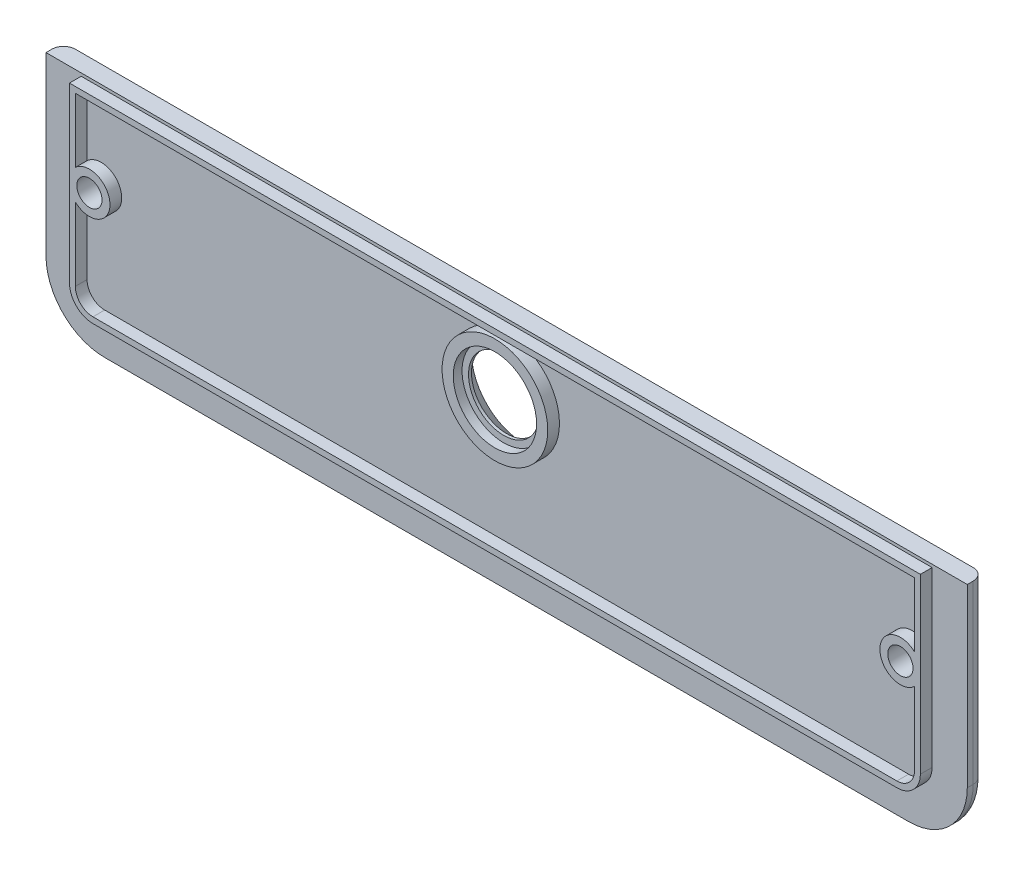
from build123d import *

# Parameters (mm, degrees)
BOSS_BASE_DEPTH    = 3
SKETCH3_R          = 2.15
BOSS_FIT_DEPTH     = 2
CUT_SCREWS_START   = -2
SKETCH4_R          = 2.15
CUT_SCREWS_DEPTH   = 2
FILLET1_R          = 2
CUT_VORON_DEPTH    = 0.6
SKETCH8_R          = 9
BOSS_BEARING_DEPTH = 2
SKETCH12_R         = 7.1
CUT_BEARING1_DEPTH = 1.5
SKETCH11_R         = 6
CUT_BEARING2_DEPTH = 157.057681644
CHAMFER2_SIZE      = 3


with BuildPart() as part:
    # Sketch2 → Boss-Base (new body)
    with BuildSketch(Plane.XY):
        with BuildLine():
            Line((-5, 35), (152, 35))
            Line((152, 35), (152, 5))
            ThreePointArc((152, 5), (149.071067812, -2.071067812), (142, -5))
            Line((142, -5), (5, -5))
            ThreePointArc((5, -5), (-2.071067812, -2.071067812), (-5, 5))
            Line((-5, 5), (-5, 35))
        make_face()
    extrude(amount=BOSS_BASE_DEPTH)

    # Sketch3 → Boss-Fit (add)
    with BuildSketch(Plane.XY.offset(3)):
        with BuildLine():
            Line((1, 5), (1, 34.5))
            Line((1, 34.5), (146, 34.5))
            Line((146, 34.5), (146, 5))
            ThreePointArc((146, 5), (144.828427125, 2.171572875), (142, 1))
            Line((142, 1), (5, 1))
            ThreePointArc((5, 1), (2.171572875, 2.171572875), (1, 5))
        make_face()
        with Locations((4.4, 20)):
            Circle(SKETCH3_R, mode=Mode.SUBTRACT)
        with Locations(Location((142.6, 20, 0), (0, 0, 180))):
            Circle(SKETCH3_R, mode=Mode.SUBTRACT)
        with BuildLine():
            Line((2, 33.5), (145, 33.5))
            Line((145, 33.5), (145, 22.547547841))
            ThreePointArc((145, 22.547547841), (139.1, 20), (145, 17.452452159))
            Line((145, 17.452452159), (145, 5))
            ThreePointArc((145, 5), (144.121320344, 2.878679656), (142, 2))
            Line((142, 2), (5, 2))
            ThreePointArc((5, 2), (2.878679656, 2.878679656), (2, 5))
            Line((2, 5), (2, 17.452452159))
            ThreePointArc((2, 17.452452159), (7.9, 20), (2, 22.547547841))
            Line((2, 22.547547841), (2, 33.5))
        make_face(mode=Mode.SUBTRACT)
    extrude(amount=BOSS_FIT_DEPTH)

    # Sketch4 → Cut-Screws (cut)
    with BuildSketch(Plane.XY.offset(3).offset(CUT_SCREWS_START)):
        with Locations((4.4, 20)):
            Circle(SKETCH4_R)
        with Locations(Location((142.6, 20, 0), (0, 0, 180))):
            Circle(SKETCH4_R)
    extrude(amount=CUT_SCREWS_DEPTH, mode=Mode.SUBTRACT)

    # Fillet1
    fillet1_edges = [part.edges().sort_by_distance(p)[0] for p in [
        (152, 20, 0),
        (149.071067812, -2.071067812, 0),
        (73.5, -5, 0),
        (-2.071067812, -2.071067812, 0),
        (-5, 20, 0),
    ]]
    fillet(fillet1_edges, radius=FILLET1_R)

    # Sketch10 → Cut-Voron (cut)
    with BuildSketch(Plane(origin=(0, 0, 0), x_dir=(-1, 0, 0), z_dir=(0, 0, -1))):
        Polygon((-140.798754771, 14), (-145, 8), (-142.25, 8), (-138.048754771, 14), align=None)
        Polygon((-136.048754771, 14), (-144.451245229, 2), (-141.701245229, 2), (-133.298754771, 14), align=None)
        Polygon((-135.5, 8), (-139.701245229, 2), (-136.951245229, 2), (-132.75, 8), align=None)
    extrude(amount=-CUT_VORON_DEPTH, mode=Mode.SUBTRACT)

    # Sketch8 → Boss-Bearing (add)
    with BuildSketch(Plane.XY.offset(3)):
        with Locations((73.5, 24)):
            Circle(SKETCH8_R)
    extrude(amount=BOSS_BEARING_DEPTH)

    # Sketch12 → Cut-Bearing1 (cut)
    with BuildSketch(Plane.XY.offset(5)):
        with Locations((73.5, 24)):
            Circle(SKETCH12_R)
    extrude(amount=-CUT_BEARING1_DEPTH, mode=Mode.SUBTRACT)

    # Sketch11 → Cut-Bearing2 (cut, through all)
    with BuildSketch(Plane.XY.offset(5)):
        with Locations((73.5, 24)):
            Circle(SKETCH11_R)
    extrude(amount=-CUT_BEARING2_DEPTH, mode=Mode.SUBTRACT)

    # Chamfer2
    chamfer2_edges = [part.edges().sort_by_distance(p)[0] for p in [
        (67.5, 24, 0),
    ]]
    chamfer(chamfer2_edges, length=CHAMFER2_SIZE)


solid = part.part
